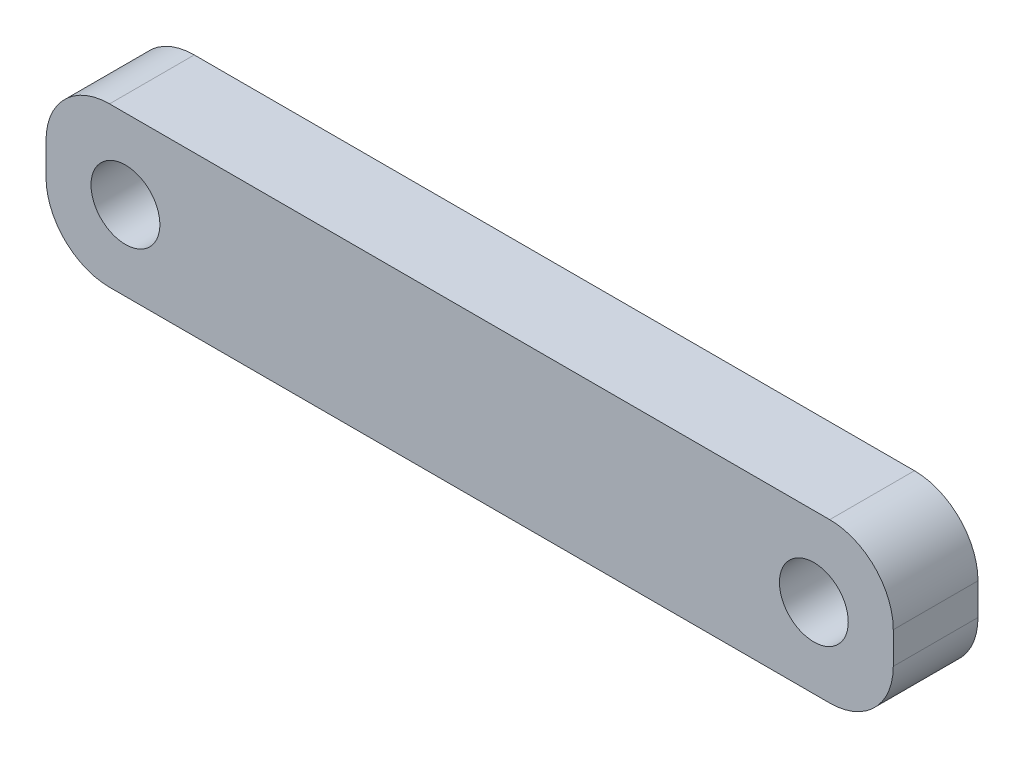
from build123d import *

# Parameters (mm, degrees)
SKETCH2_R           = 1.625
BOSS_EXTRUDE1_DEPTH = 4
FILLET1_R           = 3


with BuildPart() as part:
    # Sketch2 → Boss-Extrude1 (new body)
    with BuildSketch(Plane.XY):
        Polygon((0, 0), (20, 0), (20, 7.5), (-20, 7.5), (-20, 0), align=None)
        with Locations((16.25, 3.75)):
            Circle(SKETCH2_R, mode=Mode.SUBTRACT)
        with Locations(Location((-16.25, 3.75, 0), (0, 0, 180))):
            Circle(SKETCH2_R, mode=Mode.SUBTRACT)
    extrude(amount=BOSS_EXTRUDE1_DEPTH)

    # Fillet1
    fillet1_edges = [part.edges().sort_by_distance(p)[0] for p in [
        (-20, 0, 2),
        (-20, 7.5, 2),
        (20, 7.5, 2),
        (20, 0, 2),
    ]]
    fillet(fillet1_edges, radius=FILLET1_R)


solid = part.part
